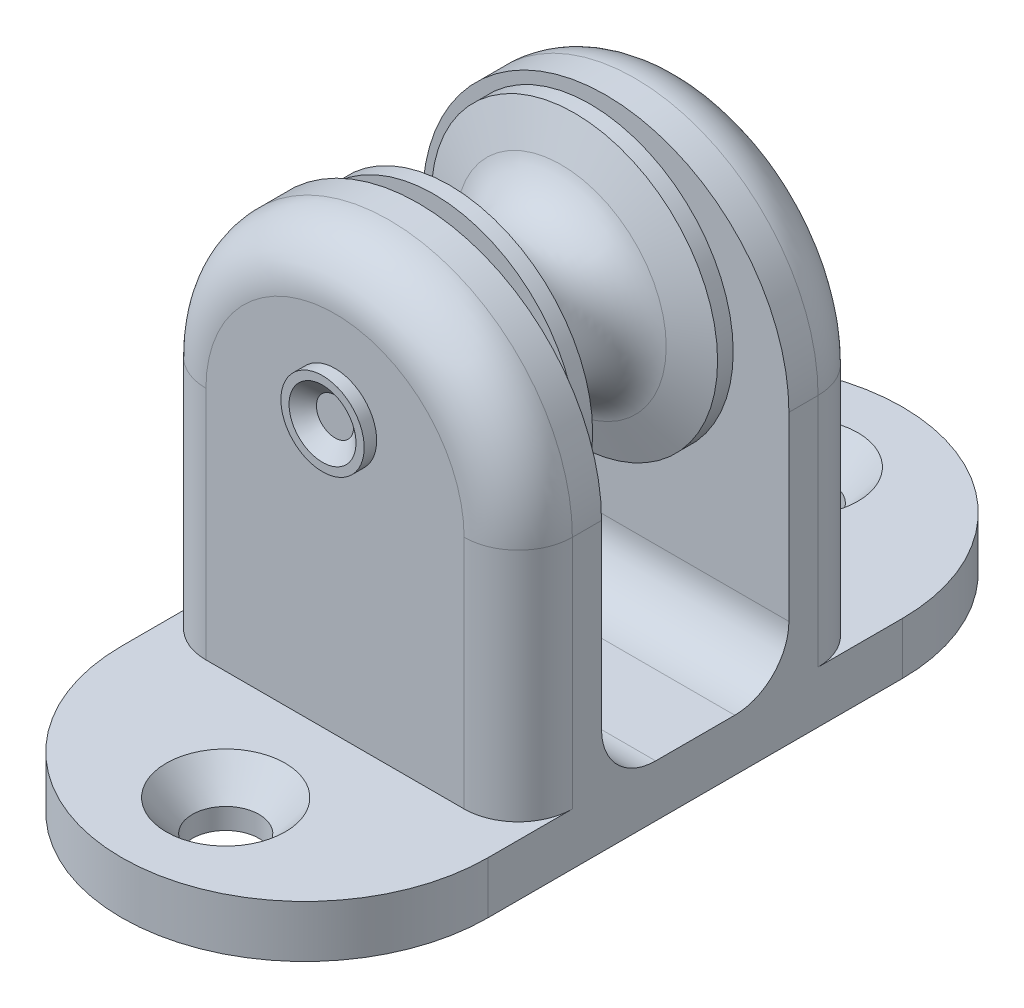
from build123d import *

# Parameters (mm, degrees)
SKETCH4_W                    = 22.352
SKETCH4_H                    = 47.625
SKETCH4_R                    = 2.032
BOSS_EXTRUDE1_DEPTH          = 3.175
SKETCH8_R                    = 2.032
CUT_EXTRUDE2_DEPTH           = 1.905
CUT_EXTRUDE2_DRAFT           = 40
CUT_EXTRUDE2_PROFILE_2_DEPTH = 1.905
CUT_EXTRUDE2_PROFILE_2_DRAFT = 40
BOSS_EXTRUDE2_DEPTH          = 5.08
FILLET1_R                    = 3.302
SKETCH7_OUTSIDE_W            = 36.338
SKETCH7_OUTSIDE_H            = 61.612
CUT_EXTRUDE1_DEPTH           = 34.02679197


with BuildPart() as part:
    # Sketch3 → Revolve1 (revolve)
    with BuildSketch(Plane(origin=(0, 0, 0), x_dir=(0, 0, -1), z_dir=(1, 0, 0)), mode=Mode.PRIVATE) as revolve1_sk:
        with BuildLine():
            Line((-4.7625, 8.73125), (-4.7625, 0))
            Line((-4.7625, 0), (4.7625, 0))
            Line((4.7625, 0), (4.7625, 8.73125))
            Line((4.7625, 8.73125), (3.81, 8.73125))
            Line((3.81, 8.73125), (2.996086106, 6.410491681))
            ThreePointArc((2.996086106, 6.410491681), (0, 4.28625), (-2.996086106, 6.410491681))
            Line((-2.996086106, 6.410491681), (-3.81, 8.73125))
            Line((-3.81, 8.73125), (-4.7625, 8.73125))
        make_face()
    revolve(revolve1_sk.sketch.rotate(Axis((0, 0, 4.7625), (0, 0, -1)), 90), axis=Axis((0, 0, 4.7625), (0, 0, -1)))

    # Sketch6 → Revolve2 (revolve)
    with BuildSketch(Plane(origin=(0, 0, 0), x_dir=(0, 0, -1), z_dir=(1, 0, 0))):
        with BuildLine():
            Line((-10.795, 1.5875), (10.795, 1.5875))
            Line((10.795, 1.5875), (10.795, 3.175))
            Line((10.795, 3.175), (11.557, 3.175))
            ThreePointArc((11.557, 3.175), (12.680268598, 1.760908927), (13.081, 0))
            Line((13.081, 0), (-10.795, 0))
            Line((-10.795, 0), (-10.795, 1.133441881))
            Line((-10.795, 1.133441881), (-11.557, 2.041558119))
            Line((-11.557, 2.041558119), (-11.557, 2.54))
            Line((-11.557, 2.54), (-10.795, 2.54))
            Line((-10.795, 2.54), (-10.795, 1.5875))
        make_face()
    revolve(axis=Axis((0, 0, -13.081), (0, 0, 1)))


with BuildPart() as body_2:
    # Sketch4 → Boss-Extrude1 (new body)
    with BuildSketch(Plane(origin=(0, -19.97075, 0), x_dir=(-1, 0, 0), z_dir=(0, 1, 0))):
        Rectangle(SKETCH4_W, SKETCH4_H)
        with Locations(Location((0, 17.4625, 0), (0, 0, 90))):
            Circle(SKETCH4_R, mode=Mode.SUBTRACT)
        with Locations(Location((0, -17.4625, 0), (0, 0, 90))):
            Circle(SKETCH4_R, mode=Mode.SUBTRACT)
    extrude(amount=BOSS_EXTRUDE1_DEPTH)


with BuildPart() as cut_extrude2_tool:
    # Sketch8 → Cut-Extrude2 (with draft: the straight prism first)
    with BuildSketch(Plane.XZ.offset(18.70075)):
        with Locations(Location((0, -17.4625, 0), (0, 0, 270))):
            Circle(SKETCH8_R)
    extrude(amount=-CUT_EXTRUDE2_DEPTH)
    # Cut-Extrude2: the draft: its side faces are tilted about the plane it starts from
    cut_extrude2_sides = [cut_extrude2_tool.faces().sort_by_distance(p)[0] for p in [
        (0, -17.74825, -15.4305),
    ]]
    draft(cut_extrude2_sides, Plane.XZ.offset(18.70075), CUT_EXTRUDE2_DRAFT)


with BuildPart() as body_2_1:
    add(body_2.part)

    # Cut-Extrude2: cut by cut_extrude2_tool
    add(cut_extrude2_tool.part, mode=Mode.SUBTRACT)


with BuildPart() as cut_extrude2_profile_2_tool:
    # Sketch8 → Cut-Extrude2 profile 2 (with draft: the straight prism first)
    with BuildSketch(Plane.XZ.offset(18.70075)):
        with Locations(Location((0, 17.4625, 0), (0, 0, 270))):
            Circle(SKETCH8_R)
    extrude(amount=-CUT_EXTRUDE2_PROFILE_2_DEPTH)
    # Cut-Extrude2 profile 2: the draft: its side faces are tilted about the plane it starts from
    cut_extrude2_profile_2_sides = [cut_extrude2_profile_2_tool.faces().sort_by_distance(p)[0] for p in [
        (0, -17.74825, 19.4945),
    ]]
    draft(cut_extrude2_profile_2_sides, Plane.XZ.offset(18.70075), CUT_EXTRUDE2_PROFILE_2_DRAFT)


with BuildPart() as body_2_2:
    add(body_2_1.part)

    # Cut-Extrude2 profile 2: cut by cut_extrude2_profile_2_tool
    add(cut_extrude2_profile_2_tool.part, mode=Mode.SUBTRACT)

    # Sketch5 → Boss-Extrude2 (add)
    with BuildSketch(Plane(origin=(0.1984375, 0, 10.795), x_dir=(-1, 0, 0), z_dir=(0, 0, -1))):
        with BuildLine():
            Line((-10.9775625, -2.44475), (-10.9775625, -16.79575))
            Line((-10.9775625, -16.79575), (11.3744375, -16.79575))
            Line((11.3744375, -16.79575), (11.3744375, -2.44475))
            ThreePointArc((11.3744375, -2.44475), (0.1984375, 8.73125), (-10.9775625, -2.44475))
        make_face()
    boss_extrude2 = extrude(amount=BOSS_EXTRUDE2_DEPTH)

    # Mirror1: Boss-Extrude2 across plane
    add(boss_extrude2.mirror(Plane.XY))

    # Fillet1
    fillet1_edges = [body_2_2.edges().sort_by_distance(p)[0] for p in [
        (11.176, -9.62025, 10.795),
        (0, 8.73125, 10.795),
        (-11.176, -9.62025, 10.795),
        (-11.176, -9.62025, -10.795),
        (11.176, -9.62025, -10.795),
        (0, 8.73125, -10.795),
        (0, -16.79575, 5.715),
        (0, -16.79575, -5.715),
    ]]
    fillet(fillet1_edges, radius=FILLET1_R)

    # Sketch7 outside → Cut-Extrude1 (cut, through all)
    with BuildSketch(Plane(origin=(0, 0, 0), x_dir=(1, 0, 0), z_dir=(0, 1, 0))):
        Rectangle(SKETCH7_OUTSIDE_W, SKETCH7_OUTSIDE_H)
        with BuildLine():
            Line((-11.176, 12.6365), (-11.176, -12.6365))
            ThreePointArc((-11.176, -12.6365), (0, -23.8125), (11.176, -12.6365))
            Line((11.176, -12.6365), (11.176, 12.6365))
            ThreePointArc((11.176, 12.6365), (0, 23.8125), (-11.176, 12.6365))
        make_face(mode=Mode.SUBTRACT)
    extrude(amount=-CUT_EXTRUDE1_DEPTH, mode=Mode.SUBTRACT)


solid = Compound([part.part, body_2_2.part])
